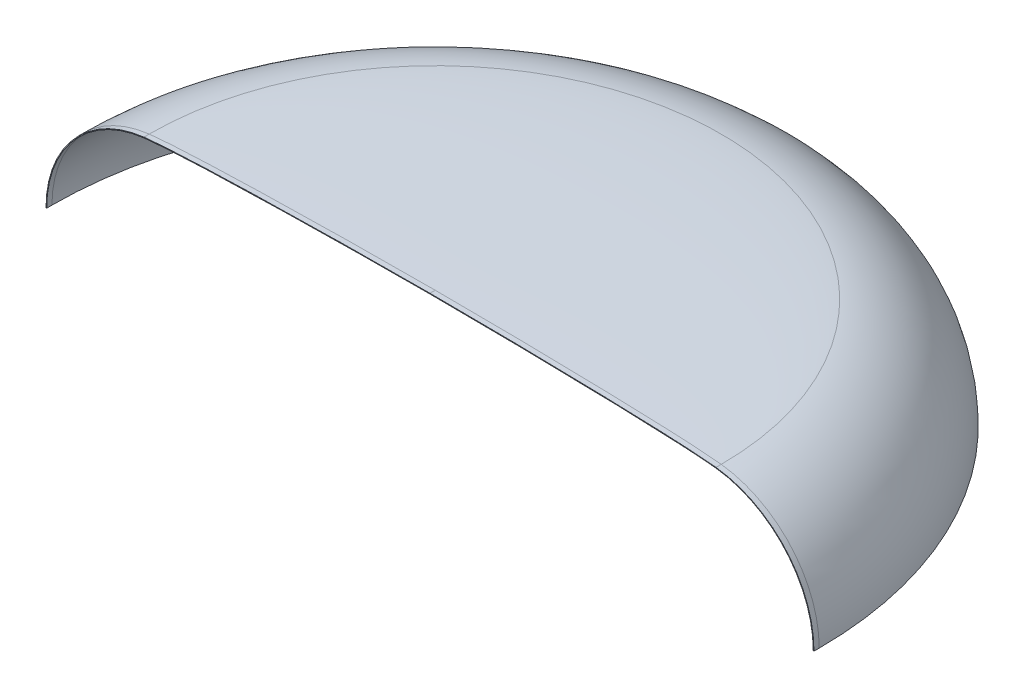
from build123d import *

# Parameters (mm, degrees)
SURFACE_REVOLVE1_2_ANGLE = 180
SURFACE_EXTRUDE1_3_DEPTH = 15
THICKEN1_T2              = 2


with BuildPart() as body_1:
    # Surface-Revolve1: a surface, the sketch's curves turned about an axis by 180 degrees
    with BuildLine(Plane.XY, mode=Mode.PRIVATE) as surface_revolve1_2_path:
        ThreePointArc((0, 0), (79.571296782, 209.280495271), (278.084607626, 312.829432448))
        add(Edge.make_bspline(
            [(278.084607626, 312.829432448), (391.549286988, 326.218815687), (812.489449679, 335), (1095, 335)],
            knots=[0, 0, 0, 0, 1, 1, 1, 1], degree=3))
    surface_revolve1_2 = Shell.revolve(surface_revolve1_2_path.wire(), SURFACE_REVOLVE1_2_ANGLE, Axis((1095, 335, 0), (0, -1, 0)))
    # Surface-Extrude1: a surface, the sketch's curves swept straight by 15 mm
    with BuildLine(Plane.XY, mode=Mode.PRIVATE) as surface_extrude1_3_path:
        ThreePointArc((2190, 0), (2110.428703218, 209.280495271), (1911.915392374, 312.829432448))
        add(Edge.make_bspline(
            [(1911.915392374, 312.829432448), (1798.450713012, 326.218815687), (1377.510550321, 335), (1095, 335)],
            knots=[0, 0, 0, 0, 1, 1, 1, 1], degree=3))
        add(Edge.make_bspline(
            [(1095, 335), (812.489449679, 335), (391.549286988, 326.218815687), (278.084607626, 312.829432448)],
            knots=[0, 0, 0, 0, 1, 1, 1, 1], degree=3))
        ThreePointArc((278.084607626, 312.829432448), (79.571296782, 209.280495271), (0, 0))
    surface_extrude1_3 = Shell.extrude(surface_extrude1_3_path.wire(), (0 * SURFACE_EXTRUDE1_3_DEPTH, 0 * SURFACE_EXTRUDE1_3_DEPTH, 1 * SURFACE_EXTRUDE1_3_DEPTH))
    # Surface-Knit1: the surfaces knitted into one
    surface_knit1_1 = Shell(Face.sew_faces(surface_revolve1_2.faces() + surface_extrude1_3.faces())[0])
    add(Solid.thicken(surface_knit1_1, -THICKEN1_T2))


solid = body_1.part
